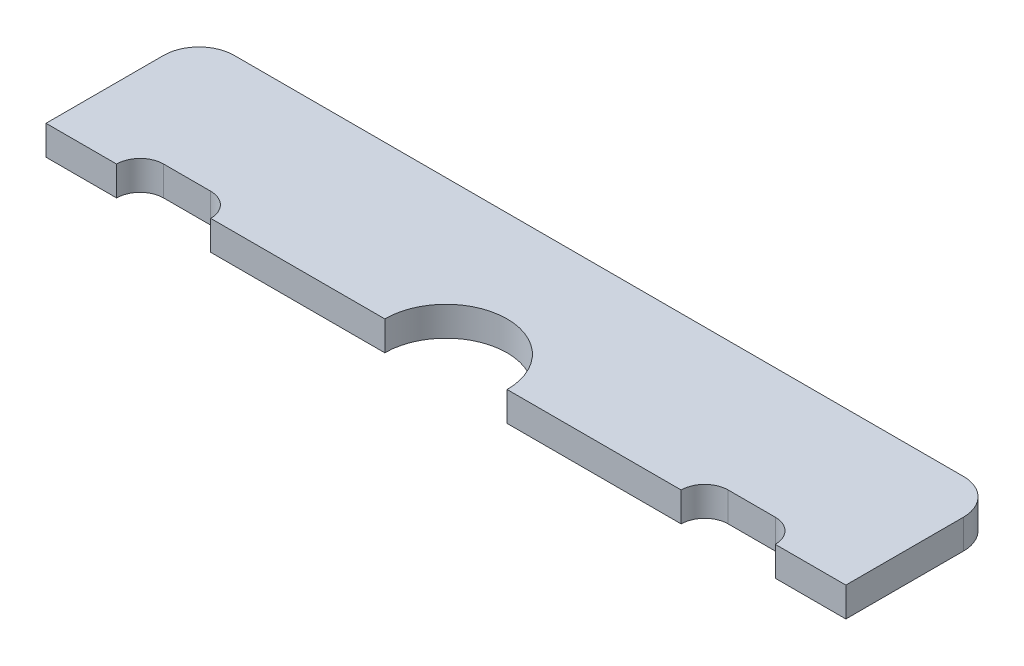
from build123d import *

# Parameters (mm, degrees)
EXTRUDE_1_DEPTH = 1.25


with BuildPart() as part:
    # 草图2 → 凸台-拉伸1 (new body)
    with BuildSketch(Plane(origin=(0, 0, 0), x_dir=(1, 0, 0), z_dir=(0, 1, 0))):
        with BuildLine():
            Line((-15.5, 6.5), (15.5, 6.5))
            ThreePointArc((15.5, 6.5), (16.560660172, 6.060660172), (17, 5))
            Line((17, 5), (17, 0))
            Line((17, 0), (14, 0))
            ThreePointArc((14, 0), (13.707106781, 0.707106781), (13, 1))
            Line((13, 1), (11, 1))
            ThreePointArc((11, 1), (10.292893219, 0.707106781), (10, 0))
            Line((10, 0), (2.6, 0))
            ThreePointArc((2.6, 0), (0, 2.6), (-2.6, 0))
            Line((-2.6, 0), (-10, 0))
            ThreePointArc((-10, 0), (-10.292893219, 0.707106781), (-11, 1))
            Line((-11, 1), (-13, 1))
            ThreePointArc((-13, 1), (-13.707106781, 0.707106781), (-14, 0))
            Line((-14, 0), (-17, 0))
            Line((-17, 0), (-17, 5))
            ThreePointArc((-17, 5), (-16.560660172, 6.060660172), (-15.5, 6.5))
        make_face()
    extrude(amount=EXTRUDE_1_DEPTH)


solid = part.part
